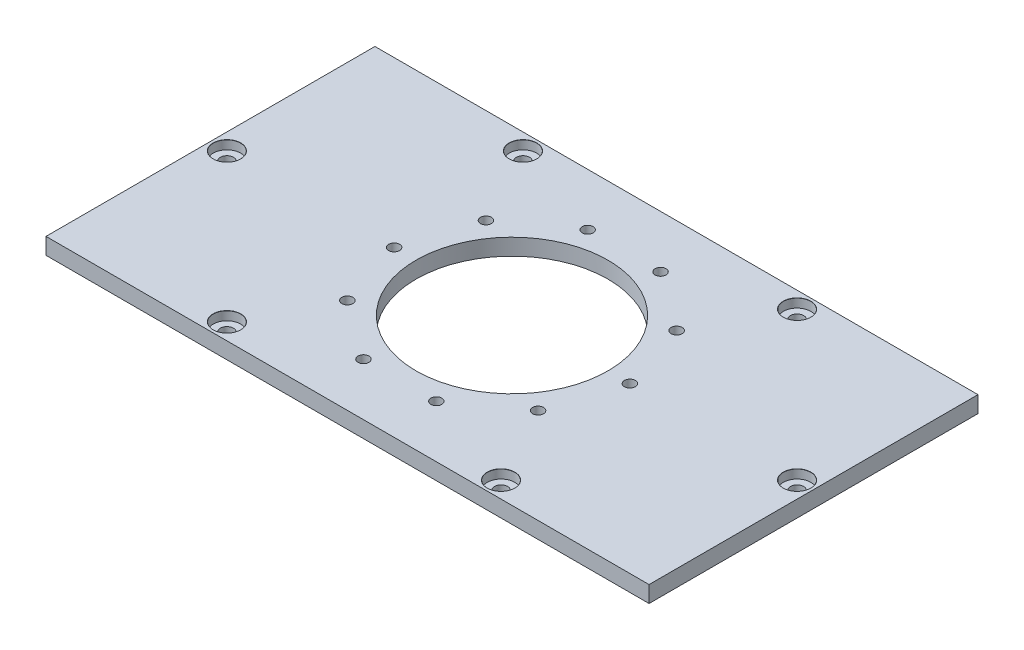
from build123d import *

# Parameters (mm, degrees)
SKIZZE1_W                                    = 110
SKIZZE1_H                                    = 60
AUFSATZ_LINEAR_AUSTRAGEN1_DEPTH              = 3
F_2_4_2_4_DURCHMESSER_BOHRUNG1_D             = 2.4
F_2_4_2_4_DURCHMESSER_BOHRUNG1_DEPTH         = 10
F_2_4_2_4_DURCHMESSER_BOHRUNG1_CSINK_D       = 2.45
F_2_4_2_4_DURCHMESSER_BOHRUNG1_CSINK_ANGLE   = 90
F_2_4_2_4_DURCHMESSER_BOHRUNG1_TIP           = 0.721032743
STIRNSENKUNG_F_R_M2_FLACHKOPFSCHRAUB_2_COUNT = 2
STIRNSENKUNG_F_R_M2_FLACHKOPFSCHRAUB_2_PITCH = 38.183766184
STIRNSENKUNG_F_R_M2_FLACHKOPFSCHRAUB_3_COUNT = 2
STIRNSENKUNG_F_R_M2_FLACHKOPFSCHRAUB_3_PITCH = 54
STIRNSENKUNG_F_R_M2_FLACHKOPFSCHRAUB_4_COUNT = 2
STIRNSENKUNG_F_R_M2_FLACHKOPFSCHRAUB_4_PITCH = 73.593477972
STIRNSENKUNG_F_R_M2_FLACHKOPFSCHRAUB_5_COUNT = 2
STIRNSENKUNG_F_R_M2_FLACHKOPFSCHRAUB_5_PITCH = 81.596568555
STIRNSENKUNG_F_R_M2_FLACHKOPFSCHRAUB_6_COUNT = 2
STIRNSENKUNG_F_R_M2_FLACHKOPFSCHRAUB_6_PITCH = 50
SKIZZE8_R                                    = 1
SKIZZE8_R_2                                  = 17.5
SCHNITT_LINEAR_AUSTRAGEN1_DEPTH              = 3


with BuildPart() as part:
    # Skizze1 → Aufsatz-Linear austragen1 (new body)
    with BuildSketch(Plane(origin=(0, 0, 0), x_dir=(1, 0, 0), z_dir=(0, 1, 0))):
        with Locations((55, 30)):
            Rectangle(SKIZZE1_W, SKIZZE1_H)
    extrude(amount=AUFSATZ_LINEAR_AUSTRAGEN1_DEPTH)

    # Ø2.4 (2.4) Durchmesser Bohrung1
    with Locations(Plane(origin=(0, 3, 0), x_dir=(1, 0, 0), z_dir=(0, 1, 0))):
        with Locations((30, 57), (80, 57), (107, 30), (80, 3), (30, 3), (3, 30), (133.088689194, 32.803420387)):
            CounterSinkHole(F_2_4_2_4_DURCHMESSER_BOHRUNG1_D / 2, F_2_4_2_4_DURCHMESSER_BOHRUNG1_CSINK_D / 2, depth=F_2_4_2_4_DURCHMESSER_BOHRUNG1_DEPTH, counter_sink_angle=F_2_4_2_4_DURCHMESSER_BOHRUNG1_CSINK_ANGLE)
            with Locations((0, 0, -(F_2_4_2_4_DURCHMESSER_BOHRUNG1_DEPTH + F_2_4_2_4_DURCHMESSER_BOHRUNG1_TIP / 2))):  # 118° drill point
                Cone(0, F_2_4_2_4_DURCHMESSER_BOHRUNG1_D / 2, F_2_4_2_4_DURCHMESSER_BOHRUNG1_TIP, mode=Mode.SUBTRACT)

    # Skizze7 → Stirnsenkung für M2 Flachkopfschraube mit Schlitz1 (revolve, cut)
    with BuildSketch(Plane(origin=(80, 3, -3), x_dir=(0, 0, 1), z_dir=(1, 0, 0))):
        Polygon((0, 0), (0, 2.721032743), (1.2, 2), (1.2, 1.6), (2.5, 1.6), (2.5, 0.025), (2.525, 0), align=None)
    stirnsenkung_f_r_m2_flachkopfschraube_mi = revolve(axis=Axis((80, 9.35, -3), (0, -1, 0)), mode=Mode.SUBTRACT)

    # Stirnsenkung f_r M2 Flachkopfschraub 2: Stirnsenkung für M2 Flachkopfschraube mit Schlitz1 ×2
    with Locations(*[Vector(0.7071067811865476, 0, -0.7071067811865476) * (i * STIRNSENKUNG_F_R_M2_FLACHKOPFSCHRAUB_2_PITCH) for i in range(1, STIRNSENKUNG_F_R_M2_FLACHKOPFSCHRAUB_2_COUNT)]):
        add(stirnsenkung_f_r_m2_flachkopfschraube_mi, mode=Mode.SUBTRACT)

    # Stirnsenkung f_r M2 Flachkopfschraub 3: Stirnsenkung für M2 Flachkopfschraube mit Schlitz1 ×2
    with Locations(*[(0, 0, -i * STIRNSENKUNG_F_R_M2_FLACHKOPFSCHRAUB_3_PITCH) for i in range(1, STIRNSENKUNG_F_R_M2_FLACHKOPFSCHRAUB_3_COUNT)]):
        add(stirnsenkung_f_r_m2_flachkopfschraube_mi, mode=Mode.SUBTRACT)

    # Stirnsenkung f_r M2 Flachkopfschraub 4: Stirnsenkung für M2 Flachkopfschraube mit Schlitz1 ×2
    with Locations(*[Vector(-0.6794080314983051, 0, -0.7337606740181692) * (i * STIRNSENKUNG_F_R_M2_FLACHKOPFSCHRAUB_4_PITCH) for i in range(1, STIRNSENKUNG_F_R_M2_FLACHKOPFSCHRAUB_4_COUNT)]):
        add(stirnsenkung_f_r_m2_flachkopfschraube_mi, mode=Mode.SUBTRACT)

    # Stirnsenkung f_r M2 Flachkopfschraub 5: Stirnsenkung für M2 Flachkopfschraube mit Schlitz1 ×2
    with Locations(*[Vector(-0.9436671340880456, 0, -0.33089626779710685) * (i * STIRNSENKUNG_F_R_M2_FLACHKOPFSCHRAUB_5_PITCH) for i in range(1, STIRNSENKUNG_F_R_M2_FLACHKOPFSCHRAUB_5_COUNT)]):
        add(stirnsenkung_f_r_m2_flachkopfschraube_mi, mode=Mode.SUBTRACT)

    # Stirnsenkung f_r M2 Flachkopfschraub 6: Stirnsenkung für M2 Flachkopfschraube mit Schlitz1 ×2
    with Locations(*[(-i * STIRNSENKUNG_F_R_M2_FLACHKOPFSCHRAUB_6_PITCH, 0, 0) for i in range(1, STIRNSENKUNG_F_R_M2_FLACHKOPFSCHRAUB_6_COUNT)]):
        add(stirnsenkung_f_r_m2_flachkopfschraube_mi, mode=Mode.SUBTRACT)

    # Skizze8 → Schnitt-Linear austragen1 (cut)
    with BuildSketch(Plane(origin=(0, 3, 0), x_dir=(1, 0, 0), z_dir=(0, 1, 0))):
        with Locations(Location((37.606134621, 42.637382924, 0), (0, 0, 270))):
            Circle(SKIZZE8_R)
        with Locations(Location((48.356134621, 50.4477151, 0), (0, 0, 270))):
            Circle(SKIZZE8_R)
        with Locations(Location((61.643865379, 50.4477151, 0), (0, 0, 270))):
            Circle(SKIZZE8_R)
        with Locations(Location((72.393865379, 42.637382924, 0), (0, 0, 270))):
            Circle(SKIZZE8_R)
        with Locations(Location((76.5, 30, 0), (0, 0, 270))):
            Circle(SKIZZE8_R)
        with Locations(Location((72.393865379, 17.362617076, 0), (0, 0, 270))):
            Circle(SKIZZE8_R)
        with Locations(Location((61.643865379, 9.5522849, 0), (0, 0, 270))):
            Circle(SKIZZE8_R)
        with Locations(Location((48.356134621, 9.5522849, 0), (0, 0, 270))):
            Circle(SKIZZE8_R)
        with Locations(Location((37.606134621, 17.362617076, 0), (0, 0, 270))):
            Circle(SKIZZE8_R)
        with Locations(Location((33.5, 30, 0), (0, 0, 270))):
            Circle(SKIZZE8_R)
        with Locations(Location((55, 30, 0), (0, 0, 270))):
            Circle(SKIZZE8_R_2)
    extrude(amount=-SCHNITT_LINEAR_AUSTRAGEN1_DEPTH, mode=Mode.SUBTRACT)


solid = part.part
